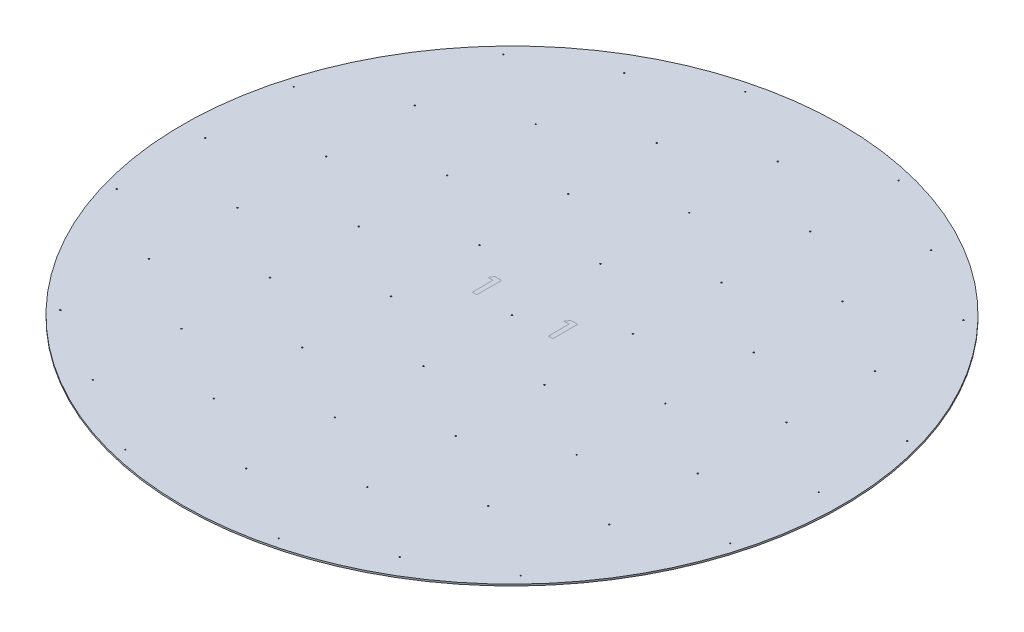
from build123d import *

# Parameters (mm, degrees)
SKETCH2_R                = 40
BOSS_EXTRUDE1_DEPTH      = 0.2
SKETCH4_R                = 0.075
CUT_EXTRUDE2_DEPTH       = 0.2
LPATTERN1_COUNT          = 4
LPATTERN1_PITCH          = 10.75
LPATTERN1_COUNT_DIR2     = 3
LPATTERN1_PITCH_DIR2     = 18.619546181
MIRROR1_COPY_1_SKETCH_R  = 0.075
MIRROR1_COPY_1_DEPTH     = 0.2
MIRROR1_COPY_2_SKETCH_R  = 0.075
MIRROR1_COPY_2_DEPTH     = 0.2
MIRROR1_COPY_3_SKETCH_R  = 0.075
MIRROR1_COPY_3_DEPTH     = 0.2
MIRROR1_COPY_4_SKETCH_R  = 0.075
MIRROR1_COPY_4_DEPTH     = 0.2
MIRROR1_COPY_5_SKETCH_R  = 0.075
MIRROR1_COPY_5_DEPTH     = 0.2
MIRROR1_COPY_6_SKETCH_R  = 0.075
MIRROR1_COPY_6_DEPTH     = 0.2
MIRROR1_COPY_7_SKETCH_R  = 0.075
MIRROR1_COPY_7_DEPTH     = 0.2
MIRROR1_COPY_8_SKETCH_R  = 0.075
MIRROR1_COPY_8_DEPTH     = 0.2
MIRROR1_COPY_9_SKETCH_R  = 0.075
MIRROR1_COPY_9_DEPTH     = 0.2
MIRROR1_COPY_10_SKETCH_R = 0.075
MIRROR1_COPY_10_DEPTH    = 0.2
MIRROR1_COPY_11_SKETCH_R = 0.075
MIRROR1_COPY_11_DEPTH    = 0.2
MIRROR1_COPY_12_SKETCH_R = 0.075
MIRROR1_COPY_12_DEPTH    = 0.2
MIRROR2_COPY_1_SKETCH_R  = 0.075
MIRROR2_COPY_1_DEPTH     = 0.2
MIRROR2_COPY_2_SKETCH_R  = 0.075
MIRROR2_COPY_2_DEPTH     = 0.2
MIRROR2_COPY_3_SKETCH_R  = 0.075
MIRROR2_COPY_3_DEPTH     = 0.2
MIRROR2_COPY_4_SKETCH_R  = 0.075
MIRROR2_COPY_4_DEPTH     = 0.2
MIRROR2_COPY_5_SKETCH_R  = 0.075
MIRROR2_COPY_5_DEPTH     = 0.2
MIRROR2_COPY_6_SKETCH_R  = 0.075
MIRROR2_COPY_6_DEPTH     = 0.2
MIRROR2_COPY_7_SKETCH_R  = 0.075
MIRROR2_COPY_7_DEPTH     = 0.2
MIRROR2_COPY_8_SKETCH_R  = 0.075
MIRROR2_COPY_8_DEPTH     = 0.2
MIRROR2_COPY_9_SKETCH_R  = 0.075
MIRROR2_COPY_9_DEPTH     = 0.2
MIRROR2_COPY_10_SKETCH_R = 0.075
MIRROR2_COPY_10_DEPTH    = 0.2
MIRROR2_COPY_11_SKETCH_R = 0.075
MIRROR2_COPY_11_DEPTH    = 0.2
MIRROR2_COPY_12_SKETCH_R = 0.075
MIRROR2_COPY_12_DEPTH    = 0.2
MIRROR2_COPY_13_SKETCH_R = 0.075
MIRROR2_COPY_13_DEPTH    = 0.2
MIRROR2_COPY_14_SKETCH_R = 0.075
MIRROR2_COPY_14_DEPTH    = 0.2
MIRROR2_COPY_15_SKETCH_R = 0.075
MIRROR2_COPY_15_DEPTH    = 0.2
MIRROR2_COPY_16_SKETCH_R = 0.075
MIRROR2_COPY_16_DEPTH    = 0.2
MIRROR2_COPY_17_SKETCH_R = 0.075
MIRROR2_COPY_17_DEPTH    = 0.2
MIRROR2_COPY_18_SKETCH_R = 0.075
MIRROR2_COPY_18_DEPTH    = 0.2
MIRROR2_COPY_19_SKETCH_R = 0.075
MIRROR2_COPY_19_DEPTH    = 0.2
MIRROR2_COPY_20_SKETCH_R = 0.075
MIRROR2_COPY_20_DEPTH    = 0.2
MIRROR2_COPY_21_SKETCH_R = 0.075
MIRROR2_COPY_21_DEPTH    = 0.2
MIRROR2_COPY_22_SKETCH_R = 0.075
MIRROR2_COPY_22_DEPTH    = 0.2
MIRROR2_COPY_23_SKETCH_R = 0.075
MIRROR2_COPY_23_DEPTH    = 0.2
MIRROR2_COPY_24_SKETCH_R = 0.075
MIRROR2_COPY_24_DEPTH    = 0.2
MIRROR2_COPY_25_SKETCH_R = 0.075
MIRROR2_COPY_25_DEPTH    = 0.2
SPLIT1_SURFACE_1_1_BACK  = 114.137
SPLIT1_SURFACE_1_1_DEPTH = 228.274
SPLIT1_SURFACE_1_2_BACK  = 114.137
SPLIT1_SURFACE_1_2_DEPTH = 228.274
SPLIT1_SURFACE_2_3_BACK  = 114.137
SPLIT1_SURFACE_2_3_DEPTH = 228.274
SPLIT1_SURFACE_2_4_BACK  = 114.137
SPLIT1_SURFACE_2_4_DEPTH = 228.274


with BuildPart() as part:
    # Sketch2 → Boss-Extrude1 (new body)
    with BuildSketch(Plane(origin=(0, 0, 0), x_dir=(1, 0, 0), z_dir=(0, 1, 0))):
        Circle(SKETCH2_R)
    extrude(amount=BOSS_EXTRUDE1_DEPTH)

    # Sketch4 → Cut-Extrude2 (cut)
    with BuildSketch(Plane(origin=(0, 0.2, 0), x_dir=(1, 0, 0), z_dir=(0, 1, 0))):
        with Locations((9.309773091, 5.375)):
            Circle(SKETCH4_R)
        Circle(SKETCH4_R)
    cut_extrude2 = extrude(amount=-CUT_EXTRUDE2_DEPTH, mode=Mode.SUBTRACT)

    # LPattern1: Cut-Extrude2 4 × 3
    with Locations(*[(j * LPATTERN1_PITCH_DIR2, 0, -i * LPATTERN1_PITCH) for i in range(LPATTERN1_COUNT) for j in range(LPATTERN1_COUNT_DIR2) if (i, j) != (0, 0)]):
        add(cut_extrude2, mode=Mode.SUBTRACT)

    # Mirror1 copy 1 sketch → Mirror1 copy 1 (cut)
    with BuildSketch(Plane(origin=(-18.619546181, 0.2, 0), x_dir=(-1, 0, 0), z_dir=(0, 1, 0))):
        with Locations((9.309773091, -5.375)):
            Circle(MIRROR1_COPY_1_SKETCH_R)
        Circle(MIRROR1_COPY_1_SKETCH_R)
    extrude(amount=-MIRROR1_COPY_1_DEPTH, mode=Mode.SUBTRACT)

    # Mirror1 copy 2 sketch → Mirror1 copy 2 (cut)
    with BuildSketch(Plane(origin=(-37.239092363, 0.2, 0), x_dir=(-1, 0, 0), z_dir=(0, 1, 0))):
        with Locations((9.309773091, -5.375)):
            Circle(MIRROR1_COPY_2_SKETCH_R)
        Circle(MIRROR1_COPY_2_SKETCH_R)
    extrude(amount=-MIRROR1_COPY_2_DEPTH, mode=Mode.SUBTRACT)

    # Mirror1 copy 3 sketch → Mirror1 copy 3 (cut)
    with BuildSketch(Plane(origin=(0, 0.2, -10.75), x_dir=(-1, 0, 0), z_dir=(0, 1, 0))):
        with Locations((9.309773091, -5.375)):
            Circle(MIRROR1_COPY_3_SKETCH_R)
        Circle(MIRROR1_COPY_3_SKETCH_R)
    extrude(amount=-MIRROR1_COPY_3_DEPTH, mode=Mode.SUBTRACT)

    # Mirror1 copy 4 sketch → Mirror1 copy 4 (cut)
    with BuildSketch(Plane(origin=(-18.619546181, 0.2, -10.75), x_dir=(-1, 0, 0), z_dir=(0, 1, 0))):
        with Locations((9.309773091, -5.375)):
            Circle(MIRROR1_COPY_4_SKETCH_R)
        Circle(MIRROR1_COPY_4_SKETCH_R)
    extrude(amount=-MIRROR1_COPY_4_DEPTH, mode=Mode.SUBTRACT)

    # Mirror1 copy 5 sketch → Mirror1 copy 5 (cut)
    with BuildSketch(Plane(origin=(-37.239092363, 0.2, -10.75), x_dir=(-1, 0, 0), z_dir=(0, 1, 0))):
        with Locations((9.309773091, -5.375)):
            Circle(MIRROR1_COPY_5_SKETCH_R)
        Circle(MIRROR1_COPY_5_SKETCH_R)
    extrude(amount=-MIRROR1_COPY_5_DEPTH, mode=Mode.SUBTRACT)

    # Mirror1 copy 6 sketch → Mirror1 copy 6 (cut)
    with BuildSketch(Plane(origin=(0, 0.2, -21.5), x_dir=(-1, 0, 0), z_dir=(0, 1, 0))):
        with Locations((9.309773091, -5.375)):
            Circle(MIRROR1_COPY_6_SKETCH_R)
        Circle(MIRROR1_COPY_6_SKETCH_R)
    extrude(amount=-MIRROR1_COPY_6_DEPTH, mode=Mode.SUBTRACT)

    # Mirror1 copy 7 sketch → Mirror1 copy 7 (cut)
    with BuildSketch(Plane(origin=(-18.619546181, 0.2, -21.5), x_dir=(-1, 0, 0), z_dir=(0, 1, 0))):
        with Locations((9.309773091, -5.375)):
            Circle(MIRROR1_COPY_7_SKETCH_R)
        Circle(MIRROR1_COPY_7_SKETCH_R)
    extrude(amount=-MIRROR1_COPY_7_DEPTH, mode=Mode.SUBTRACT)

    # Mirror1 copy 8 sketch → Mirror1 copy 8 (cut)
    with BuildSketch(Plane(origin=(-37.239092363, 0.2, -21.5), x_dir=(-1, 0, 0), z_dir=(0, 1, 0))):
        with Locations((9.309773091, -5.375)):
            Circle(MIRROR1_COPY_8_SKETCH_R)
        Circle(MIRROR1_COPY_8_SKETCH_R)
    extrude(amount=-MIRROR1_COPY_8_DEPTH, mode=Mode.SUBTRACT)

    # Mirror1 copy 9 sketch → Mirror1 copy 9 (cut)
    with BuildSketch(Plane(origin=(0, 0.2, -32.25), x_dir=(-1, 0, 0), z_dir=(0, 1, 0))):
        with Locations((9.309773091, -5.375)):
            Circle(MIRROR1_COPY_9_SKETCH_R)
        Circle(MIRROR1_COPY_9_SKETCH_R)
    extrude(amount=-MIRROR1_COPY_9_DEPTH, mode=Mode.SUBTRACT)

    # Mirror1 copy 10 sketch → Mirror1 copy 10 (cut)
    with BuildSketch(Plane(origin=(-18.619546181, 0.2, -32.25), x_dir=(-1, 0, 0), z_dir=(0, 1, 0))):
        with Locations((9.309773091, -5.375)):
            Circle(MIRROR1_COPY_10_SKETCH_R)
        Circle(MIRROR1_COPY_10_SKETCH_R)
    extrude(amount=-MIRROR1_COPY_10_DEPTH, mode=Mode.SUBTRACT)

    # Mirror1 copy 11 sketch → Mirror1 copy 11 (cut)
    with BuildSketch(Plane(origin=(-37.239092363, 0.2, -32.25), x_dir=(-1, 0, 0), z_dir=(0, 1, 0))):
        with Locations((9.309773091, -5.375)):
            Circle(MIRROR1_COPY_11_SKETCH_R)
        Circle(MIRROR1_COPY_11_SKETCH_R)
    extrude(amount=-MIRROR1_COPY_11_DEPTH, mode=Mode.SUBTRACT)

    # Mirror1 copy 12 sketch → Mirror1 copy 12 (cut)
    with BuildSketch(Plane(origin=(0, 0.2, 0), x_dir=(-1, 0, 0), z_dir=(0, 1, 0))):
        with Locations((9.309773091, -5.375)):
            Circle(MIRROR1_COPY_12_SKETCH_R)
        Circle(MIRROR1_COPY_12_SKETCH_R)
    extrude(amount=-MIRROR1_COPY_12_DEPTH, mode=Mode.SUBTRACT)

    # Mirror2 copy 1 sketch → Mirror2 copy 1 (cut)
    with BuildSketch(Plane(origin=(18.619546181, 0.2, 0), x_dir=(1, 0, 0), z_dir=(0, 1, 0))):
        with Locations((9.309773091, -5.375)):
            Circle(MIRROR2_COPY_1_SKETCH_R)
        Circle(MIRROR2_COPY_1_SKETCH_R)
    extrude(amount=-MIRROR2_COPY_1_DEPTH, mode=Mode.SUBTRACT)

    # Mirror2 copy 2 sketch → Mirror2 copy 2 (cut)
    with BuildSketch(Plane(origin=(37.239092363, 0.2, 0), x_dir=(1, 0, 0), z_dir=(0, 1, 0))):
        with Locations((9.309773091, -5.375)):
            Circle(MIRROR2_COPY_2_SKETCH_R)
        Circle(MIRROR2_COPY_2_SKETCH_R)
    extrude(amount=-MIRROR2_COPY_2_DEPTH, mode=Mode.SUBTRACT)

    # Mirror2 copy 3 sketch → Mirror2 copy 3 (cut)
    with BuildSketch(Plane(origin=(0, 0.2, 10.75), x_dir=(1, 0, 0), z_dir=(0, 1, 0))):
        with Locations((9.309773091, -5.375)):
            Circle(MIRROR2_COPY_3_SKETCH_R)
        Circle(MIRROR2_COPY_3_SKETCH_R)
    extrude(amount=-MIRROR2_COPY_3_DEPTH, mode=Mode.SUBTRACT)

    # Mirror2 copy 4 sketch → Mirror2 copy 4 (cut)
    with BuildSketch(Plane(origin=(18.619546181, 0.2, 10.75), x_dir=(1, 0, 0), z_dir=(0, 1, 0))):
        with Locations((9.309773091, -5.375)):
            Circle(MIRROR2_COPY_4_SKETCH_R)
        Circle(MIRROR2_COPY_4_SKETCH_R)
    extrude(amount=-MIRROR2_COPY_4_DEPTH, mode=Mode.SUBTRACT)

    # Mirror2 copy 5 sketch → Mirror2 copy 5 (cut)
    with BuildSketch(Plane(origin=(37.239092363, 0.2, 10.75), x_dir=(1, 0, 0), z_dir=(0, 1, 0))):
        with Locations((9.309773091, -5.375)):
            Circle(MIRROR2_COPY_5_SKETCH_R)
        Circle(MIRROR2_COPY_5_SKETCH_R)
    extrude(amount=-MIRROR2_COPY_5_DEPTH, mode=Mode.SUBTRACT)

    # Mirror2 copy 6 sketch → Mirror2 copy 6 (cut)
    with BuildSketch(Plane(origin=(0, 0.2, 21.5), x_dir=(1, 0, 0), z_dir=(0, 1, 0))):
        with Locations((9.309773091, -5.375)):
            Circle(MIRROR2_COPY_6_SKETCH_R)
        Circle(MIRROR2_COPY_6_SKETCH_R)
    extrude(amount=-MIRROR2_COPY_6_DEPTH, mode=Mode.SUBTRACT)

    # Mirror2 copy 7 sketch → Mirror2 copy 7 (cut)
    with BuildSketch(Plane(origin=(18.619546181, 0.2, 21.5), x_dir=(1, 0, 0), z_dir=(0, 1, 0))):
        with Locations((9.309773091, -5.375)):
            Circle(MIRROR2_COPY_7_SKETCH_R)
        Circle(MIRROR2_COPY_7_SKETCH_R)
    extrude(amount=-MIRROR2_COPY_7_DEPTH, mode=Mode.SUBTRACT)

    # Mirror2 copy 8 sketch → Mirror2 copy 8 (cut)
    with BuildSketch(Plane(origin=(37.239092363, 0.2, 21.5), x_dir=(1, 0, 0), z_dir=(0, 1, 0))):
        with Locations((9.309773091, -5.375)):
            Circle(MIRROR2_COPY_8_SKETCH_R)
        Circle(MIRROR2_COPY_8_SKETCH_R)
    extrude(amount=-MIRROR2_COPY_8_DEPTH, mode=Mode.SUBTRACT)

    # Mirror2 copy 9 sketch → Mirror2 copy 9 (cut)
    with BuildSketch(Plane(origin=(0, 0.2, 32.25), x_dir=(1, 0, 0), z_dir=(0, 1, 0))):
        with Locations((9.309773091, -5.375)):
            Circle(MIRROR2_COPY_9_SKETCH_R)
        Circle(MIRROR2_COPY_9_SKETCH_R)
    extrude(amount=-MIRROR2_COPY_9_DEPTH, mode=Mode.SUBTRACT)

    # Mirror2 copy 10 sketch → Mirror2 copy 10 (cut)
    with BuildSketch(Plane(origin=(18.619546181, 0.2, 32.25), x_dir=(1, 0, 0), z_dir=(0, 1, 0))):
        with Locations((9.309773091, -5.375)):
            Circle(MIRROR2_COPY_10_SKETCH_R)
        Circle(MIRROR2_COPY_10_SKETCH_R)
    extrude(amount=-MIRROR2_COPY_10_DEPTH, mode=Mode.SUBTRACT)

    # Mirror2 copy 11 sketch → Mirror2 copy 11 (cut)
    with BuildSketch(Plane(origin=(37.239092363, 0.2, 32.25), x_dir=(1, 0, 0), z_dir=(0, 1, 0))):
        with Locations((9.309773091, -5.375)):
            Circle(MIRROR2_COPY_11_SKETCH_R)
        Circle(MIRROR2_COPY_11_SKETCH_R)
    extrude(amount=-MIRROR2_COPY_11_DEPTH, mode=Mode.SUBTRACT)

    # Mirror2 copy 12 sketch → Mirror2 copy 12 (cut)
    with BuildSketch(Plane(origin=(0, 0.2, 0), x_dir=(1, 0, 0), z_dir=(0, 1, 0))):
        with Locations((9.309773091, -5.375)):
            Circle(MIRROR2_COPY_12_SKETCH_R)
        Circle(MIRROR2_COPY_12_SKETCH_R)
    extrude(amount=-MIRROR2_COPY_12_DEPTH, mode=Mode.SUBTRACT)

    # Mirror2 copy 13 sketch → Mirror2 copy 13 (cut)
    with BuildSketch(Plane(origin=(-18.619546181, 0.2, 0), x_dir=(-1, 0, 0), z_dir=(0, 1, 0))):
        with Locations((9.309773091, 5.375)):
            Circle(MIRROR2_COPY_13_SKETCH_R)
        Circle(MIRROR2_COPY_13_SKETCH_R)
    extrude(amount=-MIRROR2_COPY_13_DEPTH, mode=Mode.SUBTRACT)

    # Mirror2 copy 14 sketch → Mirror2 copy 14 (cut)
    with BuildSketch(Plane(origin=(-37.239092363, 0.2, 0), x_dir=(-1, 0, 0), z_dir=(0, 1, 0))):
        with Locations((9.309773091, 5.375)):
            Circle(MIRROR2_COPY_14_SKETCH_R)
        Circle(MIRROR2_COPY_14_SKETCH_R)
    extrude(amount=-MIRROR2_COPY_14_DEPTH, mode=Mode.SUBTRACT)

    # Mirror2 copy 15 sketch → Mirror2 copy 15 (cut)
    with BuildSketch(Plane(origin=(0, 0.2, 10.75), x_dir=(-1, 0, 0), z_dir=(0, 1, 0))):
        with Locations((9.309773091, 5.375)):
            Circle(MIRROR2_COPY_15_SKETCH_R)
        Circle(MIRROR2_COPY_15_SKETCH_R)
    extrude(amount=-MIRROR2_COPY_15_DEPTH, mode=Mode.SUBTRACT)

    # Mirror2 copy 16 sketch → Mirror2 copy 16 (cut)
    with BuildSketch(Plane(origin=(-18.619546181, 0.2, 10.75), x_dir=(-1, 0, 0), z_dir=(0, 1, 0))):
        with Locations((9.309773091, 5.375)):
            Circle(MIRROR2_COPY_16_SKETCH_R)
        Circle(MIRROR2_COPY_16_SKETCH_R)
    extrude(amount=-MIRROR2_COPY_16_DEPTH, mode=Mode.SUBTRACT)

    # Mirror2 copy 17 sketch → Mirror2 copy 17 (cut)
    with BuildSketch(Plane(origin=(-37.239092363, 0.2, 10.75), x_dir=(-1, 0, 0), z_dir=(0, 1, 0))):
        with Locations((9.309773091, 5.375)):
            Circle(MIRROR2_COPY_17_SKETCH_R)
        Circle(MIRROR2_COPY_17_SKETCH_R)
    extrude(amount=-MIRROR2_COPY_17_DEPTH, mode=Mode.SUBTRACT)

    # Mirror2 copy 18 sketch → Mirror2 copy 18 (cut)
    with BuildSketch(Plane(origin=(0, 0.2, 21.5), x_dir=(-1, 0, 0), z_dir=(0, 1, 0))):
        with Locations((9.309773091, 5.375)):
            Circle(MIRROR2_COPY_18_SKETCH_R)
        Circle(MIRROR2_COPY_18_SKETCH_R)
    extrude(amount=-MIRROR2_COPY_18_DEPTH, mode=Mode.SUBTRACT)

    # Mirror2 copy 19 sketch → Mirror2 copy 19 (cut)
    with BuildSketch(Plane(origin=(-18.619546181, 0.2, 21.5), x_dir=(-1, 0, 0), z_dir=(0, 1, 0))):
        with Locations((9.309773091, 5.375)):
            Circle(MIRROR2_COPY_19_SKETCH_R)
        Circle(MIRROR2_COPY_19_SKETCH_R)
    extrude(amount=-MIRROR2_COPY_19_DEPTH, mode=Mode.SUBTRACT)

    # Mirror2 copy 20 sketch → Mirror2 copy 20 (cut)
    with BuildSketch(Plane(origin=(-37.239092363, 0.2, 21.5), x_dir=(-1, 0, 0), z_dir=(0, 1, 0))):
        with Locations((9.309773091, 5.375)):
            Circle(MIRROR2_COPY_20_SKETCH_R)
        Circle(MIRROR2_COPY_20_SKETCH_R)
    extrude(amount=-MIRROR2_COPY_20_DEPTH, mode=Mode.SUBTRACT)

    # Mirror2 copy 21 sketch → Mirror2 copy 21 (cut)
    with BuildSketch(Plane(origin=(0, 0.2, 32.25), x_dir=(-1, 0, 0), z_dir=(0, 1, 0))):
        with Locations((9.309773091, 5.375)):
            Circle(MIRROR2_COPY_21_SKETCH_R)
        Circle(MIRROR2_COPY_21_SKETCH_R)
    extrude(amount=-MIRROR2_COPY_21_DEPTH, mode=Mode.SUBTRACT)

    # Mirror2 copy 22 sketch → Mirror2 copy 22 (cut)
    with BuildSketch(Plane(origin=(-18.619546181, 0.2, 32.25), x_dir=(-1, 0, 0), z_dir=(0, 1, 0))):
        with Locations((9.309773091, 5.375)):
            Circle(MIRROR2_COPY_22_SKETCH_R)
        Circle(MIRROR2_COPY_22_SKETCH_R)
    extrude(amount=-MIRROR2_COPY_22_DEPTH, mode=Mode.SUBTRACT)

    # Mirror2 copy 23 sketch → Mirror2 copy 23 (cut)
    with BuildSketch(Plane(origin=(-37.239092363, 0.2, 32.25), x_dir=(-1, 0, 0), z_dir=(0, 1, 0))):
        with Locations((9.309773091, 5.375)):
            Circle(MIRROR2_COPY_23_SKETCH_R)
        Circle(MIRROR2_COPY_23_SKETCH_R)
    extrude(amount=-MIRROR2_COPY_23_DEPTH, mode=Mode.SUBTRACT)

    # Mirror2 copy 24 sketch → Mirror2 copy 24 (cut)
    with BuildSketch(Plane(origin=(0, 0.2, 0), x_dir=(-1, 0, 0), z_dir=(0, 1, 0))):
        with Locations((9.309773091, 5.375)):
            Circle(MIRROR2_COPY_24_SKETCH_R)
        Circle(MIRROR2_COPY_24_SKETCH_R)
    extrude(amount=-MIRROR2_COPY_24_DEPTH, mode=Mode.SUBTRACT)

    # Mirror2 copy 25 sketch → Mirror2 copy 25 (cut)
    with BuildSketch(Plane(origin=(0, 0.2, 0), x_dir=(1, 0, 0), z_dir=(0, 1, 0))):
        with Locations((9.309773091, -5.375)):
            Circle(MIRROR2_COPY_25_SKETCH_R)
        Circle(MIRROR2_COPY_25_SKETCH_R)
    extrude(amount=-MIRROR2_COPY_25_DEPTH, mode=Mode.SUBTRACT)


with BuildPart() as body_2:
    # Split1: the piece behind the surface
    add(part.part)
    # Split1 surface 1: a surface, the sketch's curves swept straight by 228.274 mm
    with BuildLine(Plane(origin=(0, 0.2, 0), x_dir=(1, 0, 0), z_dir=(0, 1, 0)).offset(-SPLIT1_SURFACE_1_1_BACK), mode=Mode.PRIVATE) as split1_surface_1_1_path:
        Line((-5.423076923, 2.5), (-5.1015625, 3))
        Line((-5.1015625, 3), (-4.269230769, 3))
        Line((-4.269230769, 3), (-4.269230769, 0))
        Line((-4.269230769, 0), (-4.807692308, 0))
        Line((-4.807692308, 0), (-4.807692308, 2.5))
        Line((-4.807692308, 2.5), (-5.423076923, 2.5))
    split1_surface_1_1 = Shell.extrude(split1_surface_1_1_path.wire(), (0 * SPLIT1_SURFACE_1_1_DEPTH, 1 * SPLIT1_SURFACE_1_1_DEPTH, 0 * SPLIT1_SURFACE_1_1_DEPTH))
    split(bisect_by=split1_surface_1_1, keep=Keep.BOTTOM)


with BuildPart() as part_1:
    add(part.part)

    # Split1: split by a surface, the side it looks to stays
    # Split1 surface 1: a surface, the sketch's curves swept straight by 228.274 mm
    with BuildLine(Plane(origin=(0, 0.2, 0), x_dir=(1, 0, 0), z_dir=(0, 1, 0)).offset(-SPLIT1_SURFACE_1_2_BACK), mode=Mode.PRIVATE) as split1_surface_1_2_path:
        Line((-5.423076923, 2.5), (-5.1015625, 3))
        Line((-5.1015625, 3), (-4.269230769, 3))
        Line((-4.269230769, 3), (-4.269230769, 0))
        Line((-4.269230769, 0), (-4.807692308, 0))
        Line((-4.807692308, 0), (-4.807692308, 2.5))
        Line((-4.807692308, 2.5), (-5.423076923, 2.5))
    split1_surface_1_2 = Shell.extrude(split1_surface_1_2_path.wire(), (0 * SPLIT1_SURFACE_1_2_DEPTH, 1 * SPLIT1_SURFACE_1_2_DEPTH, 0 * SPLIT1_SURFACE_1_2_DEPTH))
    split(bisect_by=split1_surface_1_2, keep=Keep.TOP)


with BuildPart() as body_3:
    # Split1 2: the piece behind the surface
    add(part_1.part)
    # Split1 surface 2: a surface, the sketch's curves swept straight by 228.274 mm
    with BuildLine(Plane(origin=(0, 0.2, 0), x_dir=(1, 0, 0), z_dir=(0, 1, 0)).offset(-SPLIT1_SURFACE_2_3_BACK), mode=Mode.PRIVATE) as split1_surface_2_3_path:
        Line((3.807692308, 2.5), (4.129206731, 3))
        Line((4.129206731, 3), (4.961538462, 3))
        Line((4.961538462, 3), (4.961538462, 0))
        Line((4.961538462, 0), (4.423076923, 0))
        Line((4.423076923, 0), (4.423076923, 2.5))
        Line((4.423076923, 2.5), (3.807692308, 2.5))
    split1_surface_2_3 = Shell.extrude(split1_surface_2_3_path.wire(), (0 * SPLIT1_SURFACE_2_3_DEPTH, 1 * SPLIT1_SURFACE_2_3_DEPTH, 0 * SPLIT1_SURFACE_2_3_DEPTH))
    split(bisect_by=split1_surface_2_3, keep=Keep.BOTTOM)


with BuildPart() as part_2:
    add(part_1.part)

    # Split1 2: split by a surface, the side it looks to stays
    # Split1 surface 2: a surface, the sketch's curves swept straight by 228.274 mm
    with BuildLine(Plane(origin=(0, 0.2, 0), x_dir=(1, 0, 0), z_dir=(0, 1, 0)).offset(-SPLIT1_SURFACE_2_4_BACK), mode=Mode.PRIVATE) as split1_surface_2_4_path:
        Line((3.807692308, 2.5), (4.129206731, 3))
        Line((4.129206731, 3), (4.961538462, 3))
        Line((4.961538462, 3), (4.961538462, 0))
        Line((4.961538462, 0), (4.423076923, 0))
        Line((4.423076923, 0), (4.423076923, 2.5))
        Line((4.423076923, 2.5), (3.807692308, 2.5))
    split1_surface_2_4 = Shell.extrude(split1_surface_2_4_path.wire(), (0 * SPLIT1_SURFACE_2_4_DEPTH, 1 * SPLIT1_SURFACE_2_4_DEPTH, 0 * SPLIT1_SURFACE_2_4_DEPTH))
    split(bisect_by=split1_surface_2_4, keep=Keep.TOP)


solid = Compound([body_2.part, body_3.part, part_2.part])
